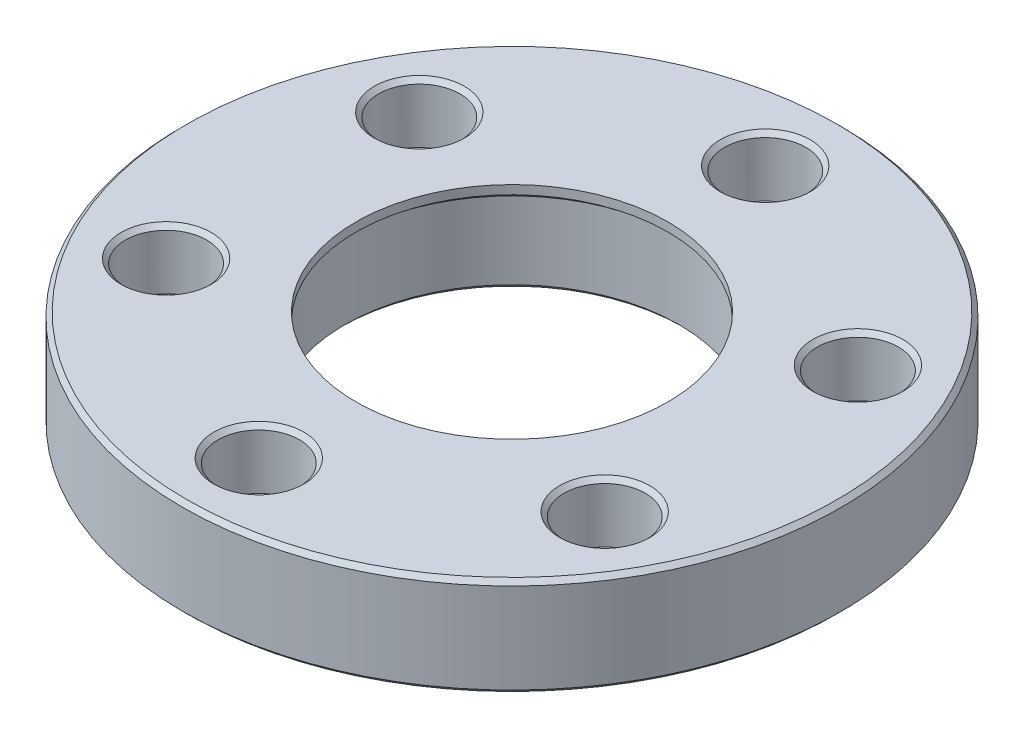
from build123d import *

# Parameters (mm, degrees)
SKETCH_1_R          = 15
SKETCH_1_R_2        = 7.1
SKETCH_1_R_3        = 1.85
EXTRUDE_1_DEPTH     = 2.7
EXTRUDE_START       = 1.8
SKETCH_2_R          = 15
SKETCH_2_R_2        = 7.1
SKETCH_2_R_3        = 0.9
EXTRUDE_2_DEPTH     = 1.8
SKETCH_3_R          = 7.6
CUT_EXTRUDE_1_DEPTH = 4.1
CHAMFER_1_SIZE      = 0.2
CHAMFER_2_SIZE      = 0.4


with BuildPart() as part:
    # 草图1 → 凸台-拉伸1 (new body)
    with BuildSketch(Plane(origin=(0, 0, 0), x_dir=(1, 0, 0), z_dir=(0, 1, 0))):
        with Locations(Location((0, 0, 0), (0, 0, 90))):
            Circle(SKETCH_1_R)
        with Locations(Location((0, 0, 0), (0, 0, 90))):
            Circle(SKETCH_1_R_2, mode=Mode.SUBTRACT)
        with Locations(Location((0, 11.525, 0), (0, 0, 90))):
            Circle(SKETCH_1_R_3, mode=Mode.SUBTRACT)
        with Locations(Location((9.980942779, 5.7625, 0), (0, 0, 90))):
            Circle(SKETCH_1_R_3, mode=Mode.SUBTRACT)
        with Locations(Location((9.980942779, -5.7625, 0), (0, 0, 90))):
            Circle(SKETCH_1_R_3, mode=Mode.SUBTRACT)
        with Locations(Location((0, -11.525, 0), (0, 0, 90))):
            Circle(SKETCH_1_R_3, mode=Mode.SUBTRACT)
        with Locations(Location((-9.980942779, -5.7625, 0), (0, 0, 90))):
            Circle(SKETCH_1_R_3, mode=Mode.SUBTRACT)
        with Locations(Location((-9.980942779, 5.7625, 0), (0, 0, 90))):
            Circle(SKETCH_1_R_3, mode=Mode.SUBTRACT)
    extrude(amount=EXTRUDE_1_DEPTH)

    # 草图2 → 凸台-拉伸2 (add)
    with BuildSketch(Plane(origin=(0, 0, 0), x_dir=(-1, 0, 0), z_dir=(0, -1, 0)).offset(EXTRUDE_START)):
        with Locations(Location((0, 0, 0), (0, 0, 90))):
            Circle(SKETCH_2_R)
        with Locations(Location((0, 0, 0), (0, 0, 90))):
            Circle(SKETCH_2_R_2, mode=Mode.SUBTRACT)
        with Locations(Location((0, 11.53, 0), (0, 0, 90))):
            Circle(SKETCH_2_R_3, mode=Mode.SUBTRACT)
        with Locations(Location((9.985272906, 5.765, 0), (0, 0, 90))):
            Circle(SKETCH_2_R_3, mode=Mode.SUBTRACT)
        with Locations(Location((9.985272906, -5.765, 0), (0, 0, 90))):
            Circle(SKETCH_2_R_3, mode=Mode.SUBTRACT)
        with Locations(Location((0, -11.53, 0), (0, 0, 90))):
            Circle(SKETCH_2_R_3, mode=Mode.SUBTRACT)
        with Locations(Location((-9.985272906, -5.765, 0), (0, 0, 90))):
            Circle(SKETCH_2_R_3, mode=Mode.SUBTRACT)
        with Locations(Location((-9.985272906, 5.765, 0), (0, 0, 90))):
            Circle(SKETCH_2_R_3, mode=Mode.SUBTRACT)
    extrude(amount=-EXTRUDE_2_DEPTH)

    # 草图3 → 切除-拉伸1 (cut)
    with BuildSketch(Plane(origin=(0, -1.8, 0), x_dir=(-1, 0, 0), z_dir=(0, -1, 0))):
        with Locations(Location((0, 0, 0), (0, 0, 90))):
            Circle(SKETCH_3_R)
    extrude(amount=-CUT_EXTRUDE_1_DEPTH, mode=Mode.SUBTRACT)

    # 倒角1
    chamfer_1_edges = [part.edges().sort_by_distance(p)[0] for p in [
        (9.980942779, 2.7, -3.9125),
        (9.980942779, 2.7, 7.6125),
        (0, 2.7, 13.375),
        (-9.980942779, 2.7, 7.6125),
        (-9.980942779, 2.7, -3.9125),
        (0, -1.8, 15),
        (0, -1.8, -10.63),
        (-9.985272906, -1.8, -4.865),
        (-9.985272906, -1.8, 6.665),
        (0, -1.8, 12.43),
        (9.985272906, -1.8, 6.665),
        (9.985272906, -1.8, -4.865),
        (0, 2.7, 15),
        (0, -1.8, 7.6),
        (0, 2.7, -9.675),
    ]]
    chamfer(chamfer_1_edges, length=CHAMFER_1_SIZE)

    # 倒角2
    chamfer_2_edges = [part.edges().sort_by_distance(p)[0] for p in [
        (0, 2.3, 7.6),
    ]]
    chamfer(chamfer_2_edges, length=CHAMFER_2_SIZE)


solid = part.part
